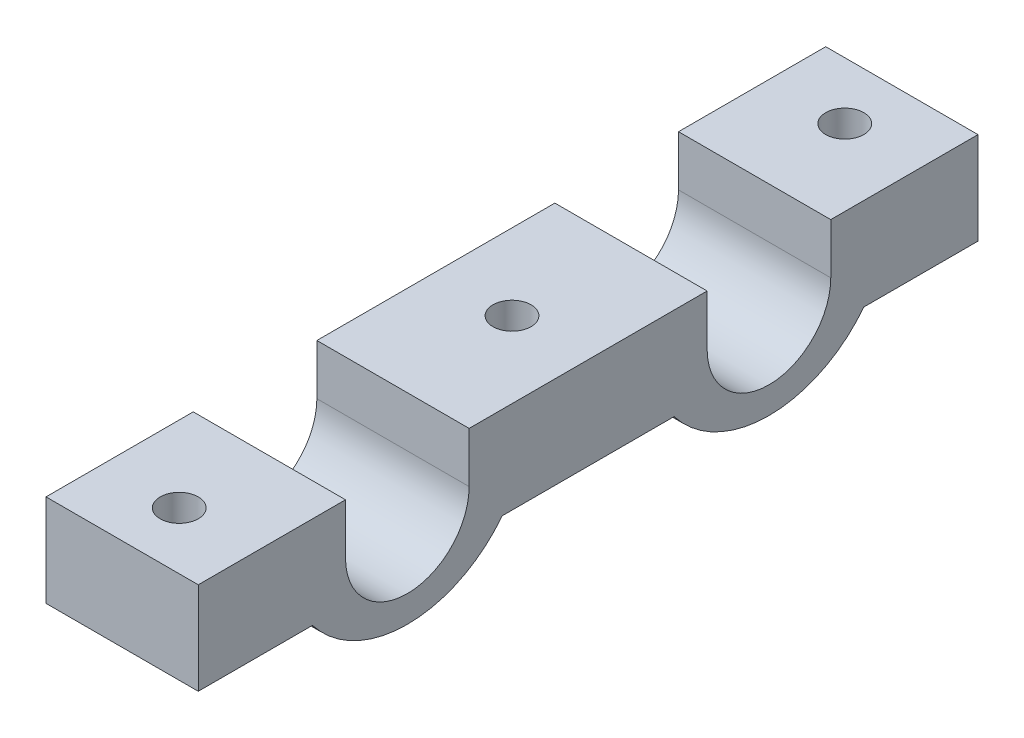
from build123d import *

# Parameters (mm, degrees)
BOSS_EXTRUDE1_DEPTH = 40
CUT_EXTRUDE1_REACH  = 161.395
SKETCH3_R           = 5


with BuildPart() as part:
    # Sketch2 → Boss-Extrude1 (new body)
    with BuildSketch(Plane(origin=(0, 0, 0), x_dir=(0, 0, -1), z_dir=(1, 0, 0))):
        with BuildLine():
            Line((-24.920224718, -11), (-54.920224718, -11))
            Line((-54.920224718, -11), (-54.920224718, 0))
            Line((-54.920224718, 0), (-54.920224718, 13.24))
            Line((-54.920224718, 13.24), (-16.24, 13.24))
            Line((-16.24, 13.24), (-16.24, 0))
            ThreePointArc((-16.24, 0), (0, -16.24), (16.24, 0))
            Line((16.24, 0), (16.24, 13.24))
            Line((16.24, 13.24), (78.76, 13.24))
            Line((78.76, 13.24), (78.76, 0))
            ThreePointArc((78.76, 0), (95, -16.24), (111.24, 0))
            Line((111.24, 0), (111.24, 13.24))
            Line((111.24, 13.24), (149.920224718, 13.24))
            Line((149.920224718, 13.24), (149.920224718, 0))
            Line((149.920224718, 0), (149.920224718, -11))
            Line((149.920224718, -11), (119.920224718, -11))
            ThreePointArc((119.920224718, -11), (95, -23.24), (70.079775282, -11))
            Line((70.079775282, -11), (24.920224718, -11))
            ThreePointArc((24.920224718, -11), (0, -23.24), (-24.920224718, -11))
        make_face()
    extrude(amount=BOSS_EXTRUDE1_DEPTH)

    # Sketch3 → Cut-Extrude1 (cut, up to next)
    with BuildSketch(Plane(origin=(0, 13.24, 0), x_dir=(1, 0, 0), z_dir=(0, 1, 0)), mode=Mode.PRIVATE) as cut_extrude1_sk1:
        with Locations(Location((20, -39.920224718, 0), (0, 0, 270))):
            Circle(SKETCH3_R)
    cut_extrude1_tool1 = extrude(cut_extrude1_sk1.sketch, amount=-CUT_EXTRUDE1_REACH, mode=Mode.PRIVATE) & part.part
    # Sketch3 → Cut-Extrude1 (cut, up to next)
    with BuildSketch(Plane(origin=(0, 13.24, 0), x_dir=(1, 0, 0), z_dir=(0, 1, 0)), mode=Mode.PRIVATE) as cut_extrude1_sk2:
        with Locations(Location((20, 134.920224718, 0), (0, 0, 270))):
            Circle(SKETCH3_R)
    cut_extrude1_tool2 = extrude(cut_extrude1_sk2.sketch, amount=-CUT_EXTRUDE1_REACH, mode=Mode.PRIVATE) & part.part
    # Sketch3 → Cut-Extrude1 (cut, up to next)
    with BuildSketch(Plane(origin=(0, 13.24, 0), x_dir=(1, 0, 0), z_dir=(0, 1, 0)), mode=Mode.PRIVATE) as cut_extrude1_sk3:
        with Locations(Location((20, 47.5, 0), (0, 0, 270))):
            Circle(SKETCH3_R)
    cut_extrude1_tool3 = extrude(cut_extrude1_sk3.sketch, amount=-CUT_EXTRUDE1_REACH, mode=Mode.PRIVATE) & part.part
    add(cut_extrude1_tool1.solids().sort_by_distance((20, 13.24, 39.920225))[0], mode=Mode.SUBTRACT)
    add(cut_extrude1_tool2.solids().sort_by_distance((20, 13.24, -134.920225))[0], mode=Mode.SUBTRACT)
    add(cut_extrude1_tool3.solids().sort_by_distance((20, 13.24, -47.5))[0], mode=Mode.SUBTRACT)


solid = part.part
